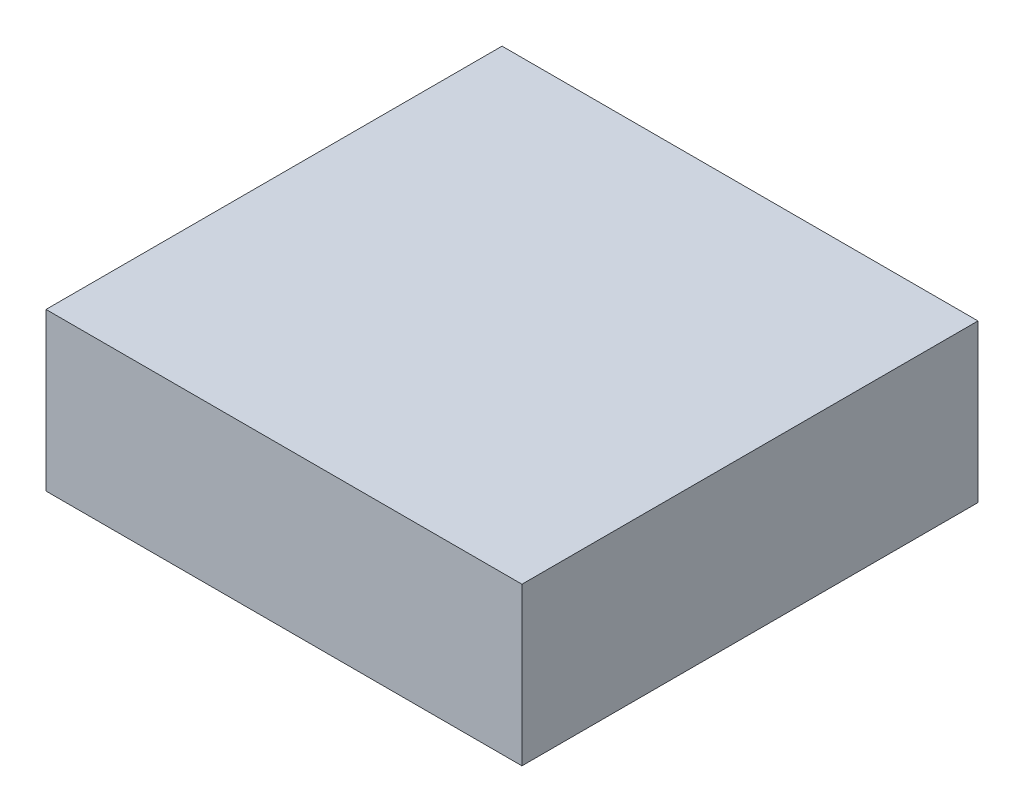
from build123d import *

# Parameters (mm, degrees)
SKETCH2_W           = 23.9
SKETCH2_H           = 22.9
BOSS_EXTRUDE1_DEPTH = 7.9


with BuildPart() as part:
    # Sketch2 → Boss-Extrude1 (new body)
    with BuildSketch(Plane(origin=(0, 0, 0), x_dir=(1, 0, 0), z_dir=(0, 1, 0))):
        Rectangle(SKETCH2_W, SKETCH2_H)
    extrude(amount=BOSS_EXTRUDE1_DEPTH)


solid = part.part
